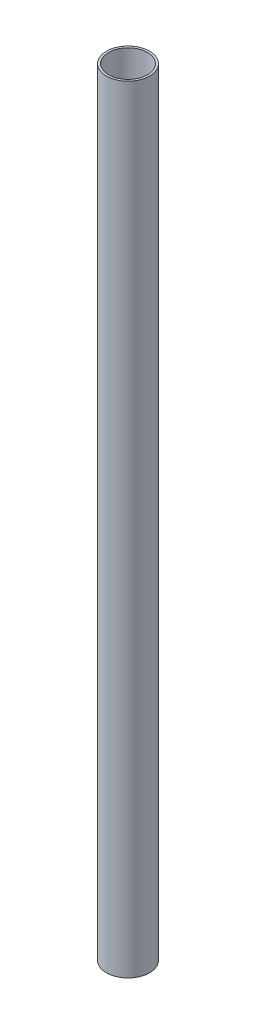
from build123d import *

# Parameters (mm, degrees)
SKETCH_1_R     = 10
SKETCH_1_R_2   = 9
F_1MM_40_DEPTH = 180


with BuildPart() as part:
    # 草图1 → 1mm*40 (new, symmetric)
    with BuildSketch(Plane(origin=(0, 0, 0), x_dir=(1, 0, 0), z_dir=(0, 1, 0))):
        Circle(SKETCH_1_R)
        Circle(SKETCH_1_R_2, mode=Mode.SUBTRACT)
    extrude(amount=F_1MM_40_DEPTH, both=True)


solid = part.part
